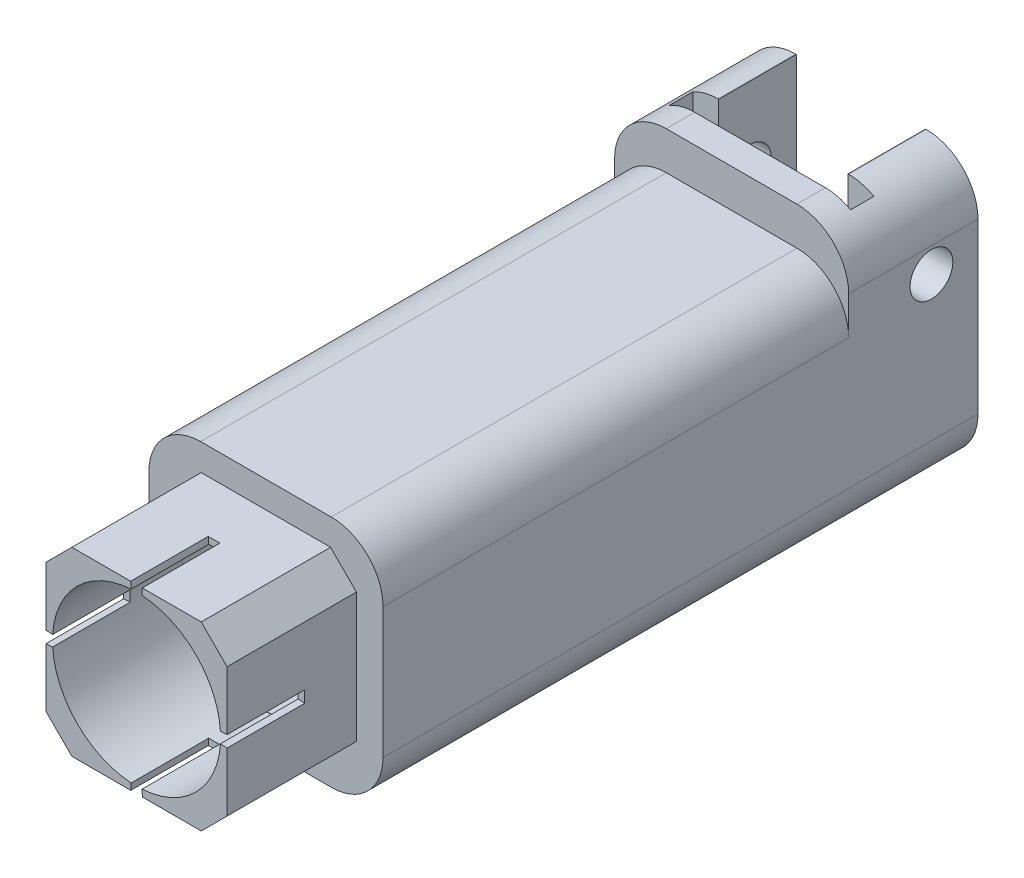
from build123d import *

# Parameters (mm, degrees)
BOSS_EXTRUDE1_DEPTH = 46
BOSS_EXTRUDE3_DEPTH = 10
SKETCH17_R          = 1.655
CUT_EXTRUDE10_DEPTH = 30
CUT_EXTRUDE11_DEPTH = 6
CUT_EXTRUDE12_DEPTH = 1.8
CUT_EXTRUDE13_DEPTH = 7.2
SKETCH22_R          = 6.5
BOSS_EXTRUDE4_DEPTH = 10
CUT_EXTRUDE14_DEPTH = 6
CIRPATTERN1_COUNT   = 4
SKETCH24_R          = 6.492418411
CUT_EXTRUDE15_DEPTH = 35


with BuildPart() as part:
    # Sketch1 → Boss-Extrude1 (new body)
    with BuildSketch(Plane.XY):
        with BuildLine():
            Line((-5.05, 9.05), (5.05, 9.05))
            ThreePointArc((5.05, 9.05), (7.878427125, 7.878427125), (9.05, 5.05))
            Line((9.05, 5.05), (9.05, -5.05))
            ThreePointArc((9.05, -5.05), (7.878427125, -7.878427125), (5.05, -9.05))
            Line((5.05, -9.05), (-5.05, -9.05))
            ThreePointArc((-5.05, -9.05), (-7.878427125, -7.878427125), (-9.05, -5.05))
            Line((-9.05, -5.05), (-9.05, 5.05))
            ThreePointArc((-9.05, 5.05), (-7.878427125, 7.878427125), (-5.05, 9.05))
        make_face()
    extrude(amount=BOSS_EXTRUDE1_DEPTH)

    # Sketch15 → Boss-Extrude3 (add)
    with BuildSketch(Plane.XY):
        with BuildLine():
            Line((-5.05, -9.05), (5.05, -9.05))
            ThreePointArc((5.05, -9.05), (7.878427125, -7.878427125), (9.05, -5.05))
            Line((9.05, -5.05), (9.05, 8))
            ThreePointArc((9.05, 8), (7.878427125, 10.828427125), (5.05, 12))
            Line((5.05, 12), (-5.05, 12))
            ThreePointArc((-5.05, 12), (-7.878427125, 10.828427125), (-9.05, 8))
            Line((-9.05, 8), (-9.05, -5.05))
            ThreePointArc((-9.05, -5.05), (-7.878427125, -7.878427125), (-5.05, -9.05))
        make_face()
    extrude(amount=BOSS_EXTRUDE3_DEPTH)

    # Sketch17 → Cut-Extrude10 (cut)
    with BuildSketch(Plane(origin=(9.05, 0, 0), x_dir=(0, 0, -1), z_dir=(1, 0, 0))):
        with Locations((-3.6, 6.1)):
            Circle(SKETCH17_R)
    extrude(amount=-CUT_EXTRUDE10_DEPTH, mode=Mode.SUBTRACT)

    # Sketch18 → Cut-Extrude11 (cut)
    with BuildSketch(Plane.XY):
        Polygon((-4.996539756, -4.259182236), (-3.851088562, -6.946129507), (-2.048481088, -4.559068161), (-0.563070773, -7.21717083), (0.983895836, -4.624244345), (2.704822485, -7.21717083), (3.469678774, -4.870091009), (4.674482161, -7.026054964), (4.998172504, -5.668676456), (4.998172504, 5.373520003), (-4.996539756, 5.373520003), align=None)
    extrude(amount=CUT_EXTRUDE11_DEPTH, mode=Mode.SUBTRACT)

    # Sketch20 → Cut-Extrude12 (cut)
    with BuildSketch(Plane(origin=(0, 0, 6), x_dir=(-1, 0, 0), z_dir=(0, 0, -1))):
        Polygon((-7, 0), (-7, 13.473809321), (7, 13.473809321), (7, 0), (7, -7.194424303), (-7, -7.194424303), align=None)
    extrude(amount=-CUT_EXTRUDE12_DEPTH, mode=Mode.SUBTRACT)

    # Sketch21 → Cut-Extrude13 (cut)
    with BuildSketch(Plane.XY):
        Polygon((5, 17.493725323), (-5, 17.493725323), (-5, 0), (-5, -0.5), (5, -0.5), (5, 0), align=None)
    extrude(amount=CUT_EXTRUDE13_DEPTH, mode=Mode.SUBTRACT)

    # Sketch22 → Boss-Extrude4 (add)
    with BuildSketch(Plane.XY.offset(46)):
        Polygon((-5.006494522, -7.003911735), (4.993505478, -7.003911735), (6.993505478, -5.003911735), (6.993505478, 4.996088265), (4.993505478, 6.996088265), (-5.006494522, 6.996088265), (-7.006494522, 4.996088265), (-7.006494522, -5.003911735), align=None)
        with Locations((-0.006494522, -0.003911735)):
            Circle(SKETCH22_R, mode=Mode.SUBTRACT)
    extrude(amount=BOSS_EXTRUDE4_DEPTH)

    # Sketch23 → Cut-Extrude14 (cut)
    with BuildSketch(Plane.XY.offset(56)):
        Polygon((0, 0), (7, 0.45), (7, -0.45), align=None)
    cut_extrude14 = extrude(amount=-CUT_EXTRUDE14_DEPTH, mode=Mode.SUBTRACT)

    # CirPattern1: Cut-Extrude14 ×4 about axis
    cirpattern1_axis = Axis((-0.006494522, -0.003911735, 0), (0, 0, 1))
    for i in range(1, CIRPATTERN1_COUNT):
        add(cut_extrude14.rotate(cirpattern1_axis, i * 360 / CIRPATTERN1_COUNT), mode=Mode.SUBTRACT)

    # Sketch24 → Cut-Extrude15 (cut)
    with BuildSketch(Plane.XY.offset(46)):
        Circle(SKETCH24_R)
    extrude(amount=-CUT_EXTRUDE15_DEPTH, mode=Mode.SUBTRACT)


solid = part.part
